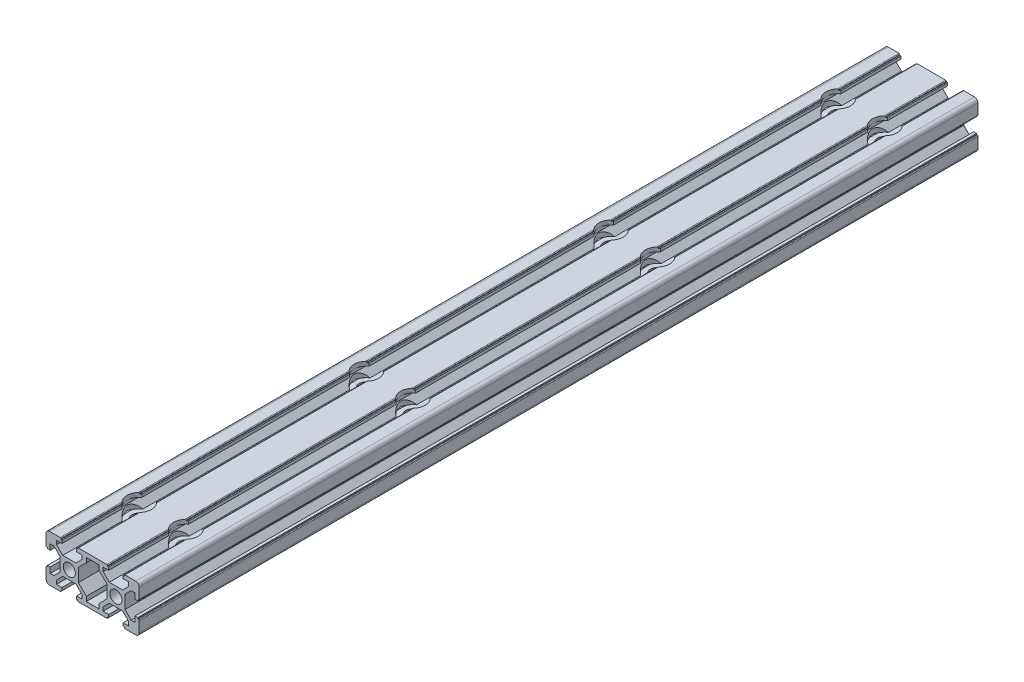
from build123d import *

# Parameters (mm, degrees)
SKETCH_1_R               = 2.6
EXTRUDE_1_DEPTH          = 180
FILLET_1_R               = 1.5
FILLET_2_R               = 0.3
CUT_EXTRUDE_1_DEPTH      = 182.640331424
CUT_EXTRUDE_1_DEPTH_BACK = 182.640331424
SKETCH_3_R               = 3.1
SKETCH_4_R               = 5.25
CUT_EXTRUDE_2_DEPTH      = 182.640331524


with BuildPart() as part:
    # 草图1 → 凸台-拉伸1 (new, symmetric)
    with BuildSketch(Plane.XY):
        Polygon((-13.9, 0), (-13.9, 2.839339828), (-16.560660172, 5.5), (-18.2, 5.5), (-18.2, 3.1), (-19.4, 3.1), (-19.4, 3.6), (-20, 3.6), (-20, 10), (-13.6, 10), (-13.6, 9.4), (-13.1, 9.4), (-13.1, 8.2), (-15.5, 8.2), (-15.5, 6.560660172), (-12.839339828, 3.9), (-7.160660172, 3.9), (-4.5, 6.560660172), (-4.5, 8.2), (-6.9, 8.2), (-6.9, 9.4), (-6.4, 9.4), (-6.4, 10), (6.4, 10), (6.4, 9.4), (6.9, 9.4), (6.9, 8.2), (4.5, 8.2), (4.5, 6.560660172), (7.160660172, 3.9), (12.839339828, 3.9), (15.5, 6.560660172), (15.5, 8.2), (13.1, 8.2), (13.1, 9.4), (13.6, 9.4), (13.6, 10), (20, 10), (20, 3.6), (19.4, 3.6), (19.4, 3.1), (18.2, 3.1), (18.2, 5.5), (16.560660172, 5.5), (13.9, 2.839339828), (13.9, 0), (13.9, -2.839339828), (16.560660172, -5.5), (18.2, -5.5), (18.2, -3.1), (19.4, -3.1), (19.4, -3.6), (20, -3.6), (20, -10), (13.6, -10), (13.6, -9.4), (13.1, -9.4), (13.1, -8.2), (15.5, -8.2), (15.5, -6.560660172), (12.839339828, -3.9), (7.160660172, -3.9), (4.5, -6.560660172), (4.5, -8.2), (6.9, -8.2), (6.9, -9.4), (6.4, -9.4), (6.4, -10), (-6.4, -10), (-6.4, -9.4), (-6.9, -9.4), (-6.9, -8.2), (-4.5, -8.2), (-4.5, -6.560660172), (-7.160660172, -3.9), (-12.839339828, -3.9), (-15.5, -6.560660172), (-15.5, -8.2), (-13.1, -8.2), (-13.1, -9.4), (-13.6, -9.4), (-13.6, -10), (-20, -10), (-20, -3.6), (-19.4, -3.6), (-19.4, -3.1), (-18.2, -3.1), (-18.2, -5.5), (-16.560660172, -5.5), (-13.9, -2.839339828), align=None)
        with Locations(Location((-10, 0, 0), (0, 0, 180))):
            Circle(SKETCH_1_R, mode=Mode.SUBTRACT)
        with Locations(Location((10, 0, 0), (0, 0, 180))):
            Circle(SKETCH_1_R, mode=Mode.SUBTRACT)
        Polygon((-6.1, -2.839339828), (-6.1, 2.839339828), (-2.7, 6.239339828), (-2.7, 8.2), (2.7, 8.2), (2.7, 6.239339828), (6.1, 2.839339828), (6.1, -2.839339828), (2.7, -6.239339828), (2.7, -8.2), (-2.7, -8.2), (-2.7, -6.239339828), align=None, mode=Mode.SUBTRACT)
    extrude(amount=EXTRUDE_1_DEPTH, both=True)

    # 圆角1
    fillet_1_edges = [part.edges().sort_by_distance(p)[0] for p in [
        (-20, 10, 0),
        (20, 10, 0),
        (20, -10, 0),
        (-20, -10, 0),
    ]]
    fillet(fillet_1_edges, radius=FILLET_1_R)

    # 圆角2
    fillet_2_edges = [part.edges().sort_by_distance(p)[0] for p in [
        (-20, 3.6, 0),
        (-13.6, 10, 0),
        (-6.4, 10, 0),
        (6.4, 10, 0),
        (13.6, 10, 0),
        (20, 3.6, 0),
        (20, -3.6, 0),
        (13.6, -10, 0),
        (6.4, -10, 0),
        (-6.4, -10, 0),
        (-13.6, -10, 0),
        (-20, -3.6, 0),
    ]]
    fillet(fillet_2_edges, radius=FILLET_2_R)

    # 草图3 → 切除-拉伸1 (cut, two sides: drawn at the far end of the back side and taken through both)
    with BuildSketch(Plane.XZ.offset(3.9).offset(-CUT_EXTRUDE_1_DEPTH_BACK)):
        with Locations(Location((-10, -150, 0), (0, 0, 336.336158428))):
            Circle(SKETCH_3_R)
        with Locations(Location((10, -150, 0), (0, 0, 203.663841572))):
            Circle(SKETCH_3_R)
        with Locations(Location((10, 150, 0), (0, 0, 203.663841572))):
            Circle(SKETCH_3_R)
        with Locations(Location((-10, 150, 0), (0, 0, 336.336158428))):
            Circle(SKETCH_3_R)
        with Locations(Location((-10, -52.5, 0), (0, 0, 336.336158428))):
            Circle(SKETCH_3_R)
        with Locations(Location((10, -52.5, 0), (0, 0, 203.663841572))):
            Circle(SKETCH_3_R)
        with Locations(Location((10, 52.5, 0), (0, 0, 203.663841572))):
            Circle(SKETCH_3_R)
        with Locations(Location((-10, 52.5, 0), (0, 0, 336.336158428))):
            Circle(SKETCH_3_R)
    extrude(amount=CUT_EXTRUDE_1_DEPTH + CUT_EXTRUDE_1_DEPTH_BACK, mode=Mode.SUBTRACT)

    # 草图4 → 切除-拉伸2 (cut, through all)
    with BuildSketch(Plane(origin=(0, 3.9, 0), x_dir=(1, 0, 0), z_dir=(0, 1, 0))):
        with Locations((-10, -150)):
            Circle(SKETCH_4_R)
        with Locations((10, -150)):
            Circle(SKETCH_4_R)
        with Locations((-10, 150)):
            Circle(SKETCH_4_R)
        with Locations((10, 150)):
            Circle(SKETCH_4_R)
        with Locations((-10, 52.5)):
            Circle(SKETCH_4_R)
        with Locations((10, 52.5)):
            Circle(SKETCH_4_R)
        with Locations((-10, -52.5)):
            Circle(SKETCH_4_R)
        with Locations((10, -52.5)):
            Circle(SKETCH_4_R)
    extrude(amount=CUT_EXTRUDE_2_DEPTH, mode=Mode.SUBTRACT)


solid = part.part
